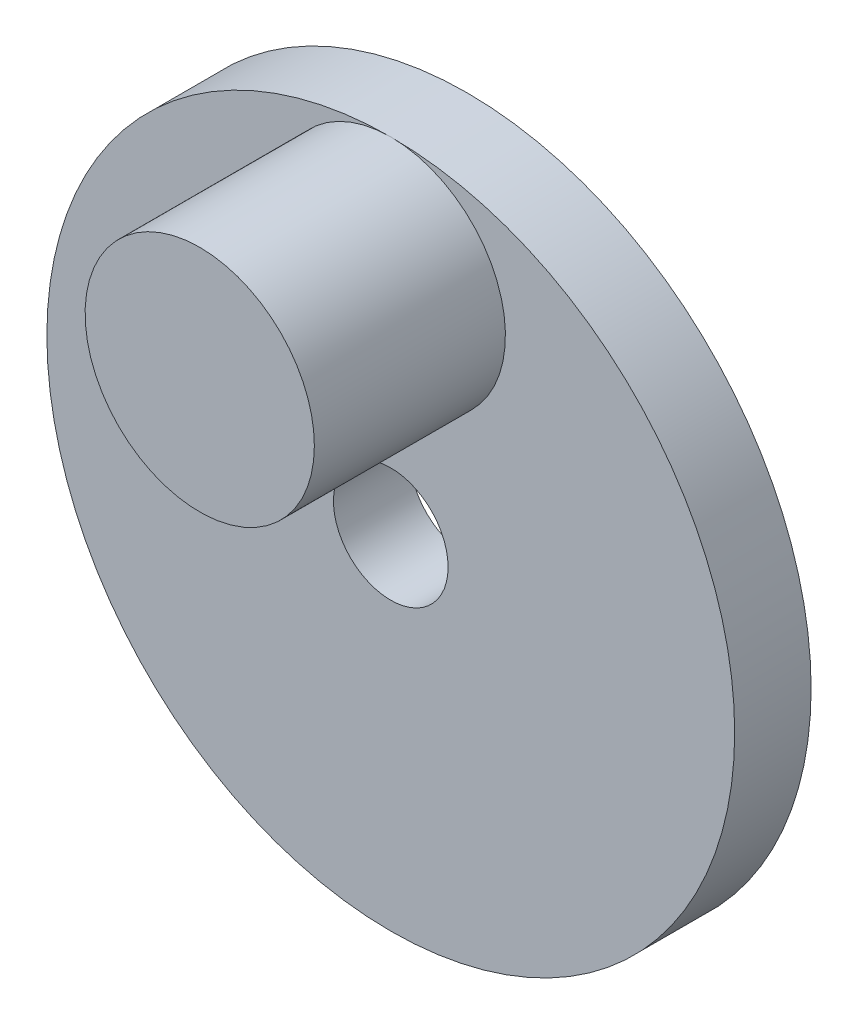
from build123d import *

# Parameters (mm, degrees)
ESBO_O1_R                = 9
ESBO_O1_R_2              = 1.5
RESSALTO_EXTRUS_O1_DEPTH = 2
ESBO_O2_R                = 3
RESSALTO_EXTRUS_O2_DEPTH = 5


with BuildPart() as part:
    # Esboço1 → Ressalto-extrusão1 (new body)
    with BuildSketch(Plane.XY):
        Circle(ESBO_O1_R)
        Circle(ESBO_O1_R_2, mode=Mode.SUBTRACT)
    extrude(amount=RESSALTO_EXTRUS_O1_DEPTH)

    # Esboço2 → Ressalto-extrusão2 (add)
    with BuildSketch(Plane.XY.offset(2)):
        with Locations(Location((0, 6, 0), (0, 0, 90))):
            Circle(ESBO_O2_R)
    extrude(amount=RESSALTO_EXTRUS_O2_DEPTH)


solid = part.part
